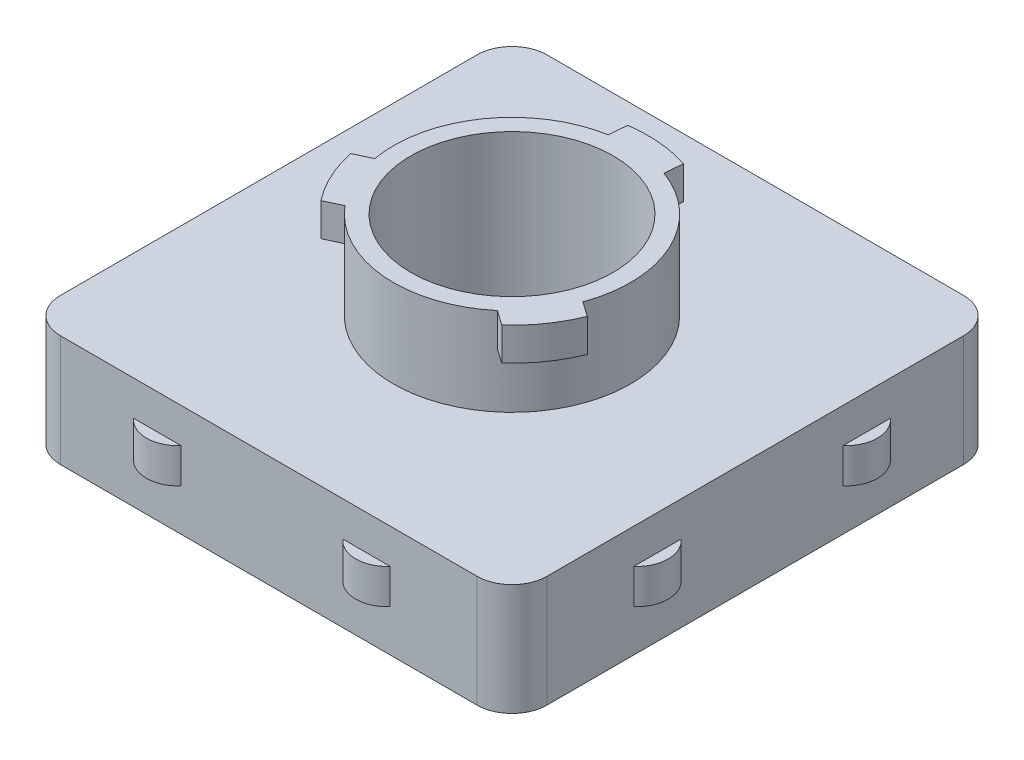
from build123d import *

# Parameters (mm, degrees)
SKETCH1_W                = 44.29506
SKETCH1_H                = 44.29506
BOSS_EXTRUDE1_DEPTH      = 10.16
SKETCH2_R                = 10.795
SKETCH2_R_2              = 9.2075
BOSS_EXTRUDE2_DEPTH      = 8
BOSS_EXTRUDE3_START      = -3
BOSS_EXTRUDE3_DEPTH      = 3
CIRPATTERN1_COUNT        = 3
BOSS_EXTRUDE4_DEPTH      = 6.35
CUT_EXTRUDE1_DEPTH       = 3.175
LPATTERN1_COUNT          = 2
LPATTERN1_PITCH          = 19.05
FILLET1_R                = 3.175
CIRPATTERN2_COUNT        = 2
CIRPATTERN2_ANGLE        = 90
CIRPATTERN2_COPY_1_DEPTH = 6.35
CIRPATTERN2_COPY_2_DEPTH = 3.175
SKETCH13_R               = 9.2075
CUT_EXTRUDE2_DEPTH       = 35.245537666


with BuildPart() as part:
    # Sketch1 → Boss-Extrude1 (new body)
    with BuildSketch(Plane(origin=(0, 0, 0), x_dir=(1, 0, 0), z_dir=(0, 1, 0))):
        Rectangle(SKETCH1_W, SKETCH1_H)
    extrude(amount=BOSS_EXTRUDE1_DEPTH)

    # Sketch2 → Boss-Extrude2 (add)
    with BuildSketch(Plane(origin=(0, 10.16, 0), x_dir=(1, 0, 0), z_dir=(0, 1, 0))):
        with Locations(Location((0, 0, 0), (0, 0, 90))):
            Circle(SKETCH2_R)
        with Locations(Location((0, 0, 0), (0, 0, 270))):
            Circle(SKETCH2_R_2, mode=Mode.SUBTRACT)
    extrude(amount=BOSS_EXTRUDE2_DEPTH)

    # Sketch5 → Boss-Extrude3 (add)
    with BuildSketch(Plane(origin=(0, 18.16, 0), x_dir=(1, 0, 0), z_dir=(0, 1, 0)).offset(BOSS_EXTRUDE3_START)):
        with BuildLine():
            ThreePointArc((10.143998982, -3.692060354), (8.842746318, -6.19175763), (6.938853856, -8.269481977))
            Line((6.938853856, -8.269481977), (8.286221198, -9.212918747))
            ThreePointArc((8.286221198, -9.212918747), (10.150194049, -7.107242387), (11.491366324, -4.635497124))
            Line((11.491366324, -4.635497124), (10.143998982, -3.692060354))
        make_face()
    boss_extrude3 = extrude(amount=BOSS_EXTRUDE3_DEPTH)

    # CirPattern1: Boss-Extrude3 ×3 about axis
    cirpattern1_axis = Axis((0, 0, 0), (0, 1, 0))
    for i in range(1, CIRPATTERN1_COUNT):
        add(boss_extrude3.rotate(cirpattern1_axis, i * 360 / CIRPATTERN1_COUNT))

    # Sketch6 → Boss-Extrude4 (add)
    with BuildSketch(Plane(origin=(0, 10.16, 0), x_dir=(1, 0, 0), z_dir=(0, 1, 0))):
        with BuildLine():
            Line((-12.30653, 22.14753), (-7.98853, 22.14753))
            ThreePointArc((-7.98853, 22.14753), (-10.14753, 23.125), (-12.30653, 22.14753))
        make_face()
        with BuildLine():
            Line((-7.98853, -22.14753), (-12.30653, -22.14753))
            ThreePointArc((-12.30653, -22.14753), (-10.14753, -23.125), (-7.98853, -22.14753))
        make_face()
    boss_extrude4 = extrude(amount=-BOSS_EXTRUDE4_DEPTH)

    # Sketch7 → Cut-Extrude1 (cut)
    with BuildSketch(Plane(origin=(0, 10.16, 0), x_dir=(1, 0, 0), z_dir=(0, 1, 0))):
        with BuildLine():
            Line((-7.98853, 22.14753), (-12.30653, 22.14753))
            ThreePointArc((-12.30653, 22.14753), (-10.14753, 23.125), (-7.98853, 22.14753))
        make_face()
        with BuildLine():
            Line((-12.30653, -22.14753), (-7.98853, -22.14753))
            ThreePointArc((-7.98853, -22.14753), (-10.14753, -23.125), (-12.30653, -22.14753))
        make_face()
    cut_extrude1 = extrude(amount=-CUT_EXTRUDE1_DEPTH, mode=Mode.SUBTRACT)

    # LPattern1: Boss-Extrude4, Cut-Extrude1 ×2
    with Locations(*[(i * LPATTERN1_PITCH, 0, 0) for i in range(1, LPATTERN1_COUNT)]):
        add(boss_extrude4)
        add(cut_extrude1, mode=Mode.SUBTRACT)

    # Fillet1
    fillet1_edges = [part.edges().sort_by_distance(p)[0] for p in [
        (22.14753, 5.08, 22.14753),
        (-22.14753, 5.08, 22.14753),
        (-22.14753, 5.08, -22.14753),
        (22.14753, 5.08, -22.14753),
    ]]
    fillet(fillet1_edges, radius=FILLET1_R)

    # CirPattern2: Boss-Extrude4, Cut-Extrude1 ×2 about axis
    cirpattern2_axis = Axis((0, 0, 0), (0, -1, 0))
    add([boss_extrude4.rotate(cirpattern2_axis, i * CIRPATTERN2_ANGLE / (CIRPATTERN2_COUNT - 1)) for i in range(1, CIRPATTERN2_COUNT)])
    add([cut_extrude1.rotate(cirpattern2_axis, i * CIRPATTERN2_ANGLE / (CIRPATTERN2_COUNT - 1)) for i in range(1, CIRPATTERN2_COUNT)], mode=Mode.SUBTRACT)

    # CirPattern2 copy 1 sketch → CirPattern2 copy 1 (add)
    with BuildSketch(Plane(origin=(0, 10.16, 19.05), x_dir=(0, 0, 1), z_dir=(0, 1, 0))):
        with BuildLine():
            Line((-12.30653, 22.14753), (-7.98853, 22.14753))
            ThreePointArc((-7.98853, 22.14753), (-10.14753, 23.125), (-12.30653, 22.14753))
        make_face()
        with BuildLine():
            Line((-7.98853, -22.14753), (-12.30653, -22.14753))
            ThreePointArc((-12.30653, -22.14753), (-10.14753, -23.125), (-7.98853, -22.14753))
        make_face()
    extrude(amount=-CIRPATTERN2_COPY_1_DEPTH)

    # CirPattern2 copy 2 sketch → CirPattern2 copy 2 (cut)
    with BuildSketch(Plane(origin=(0, 10.16, 19.05), x_dir=(0, 0, 1), z_dir=(0, 1, 0))):
        with BuildLine():
            Line((-7.98853, 22.14753), (-12.30653, 22.14753))
            ThreePointArc((-12.30653, 22.14753), (-10.14753, 23.125), (-7.98853, 22.14753))
        make_face()
        with BuildLine():
            Line((-12.30653, -22.14753), (-7.98853, -22.14753))
            ThreePointArc((-7.98853, -22.14753), (-10.14753, -23.125), (-12.30653, -22.14753))
        make_face()
    extrude(amount=-CIRPATTERN2_COPY_2_DEPTH, mode=Mode.SUBTRACT)

    # Sketch13 → Cut-Extrude2 (cut, through all)
    with BuildSketch(Plane(origin=(0, 10.16, 0), x_dir=(1, 0, 0), z_dir=(0, 1, 0))):
        with Locations(Location((0, 0, 0), (0, 0, 270))):
            Circle(SKETCH13_R)
    extrude(amount=-CUT_EXTRUDE2_DEPTH, mode=Mode.SUBTRACT)


solid = part.part
